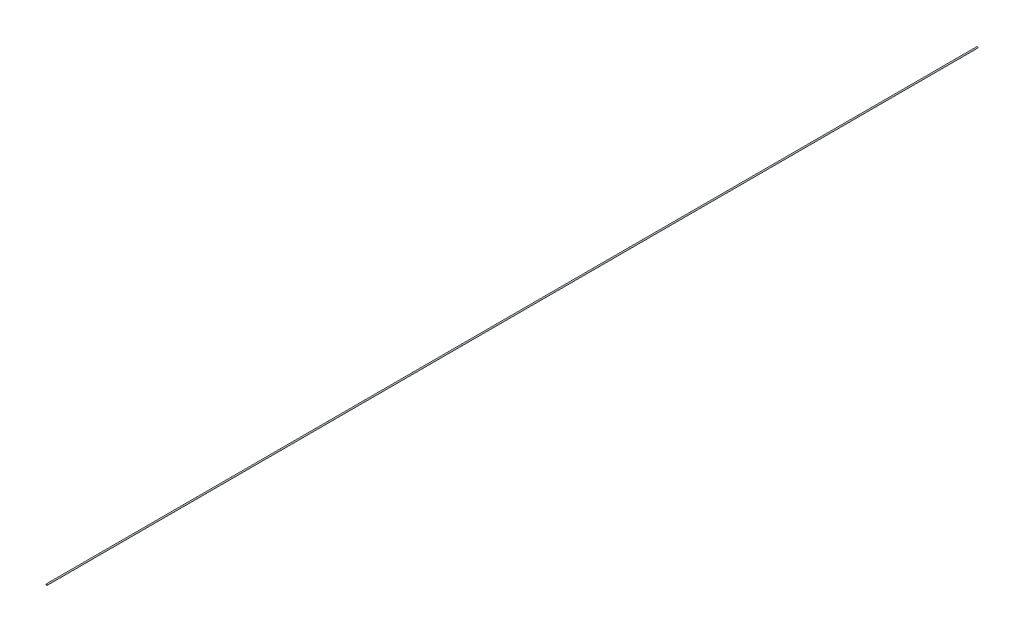
from build123d import *

# Parameters (mm, degrees)
SKETCH1_R      = 3.175
EXTRUDE1_DEPTH = 4572


with BuildPart() as part:
    # Sketch1 → Extrude1 (new body)
    with BuildSketch(Plane.XY):
        Circle(SKETCH1_R)
    extrude(amount=EXTRUDE1_DEPTH)


solid = part.part
